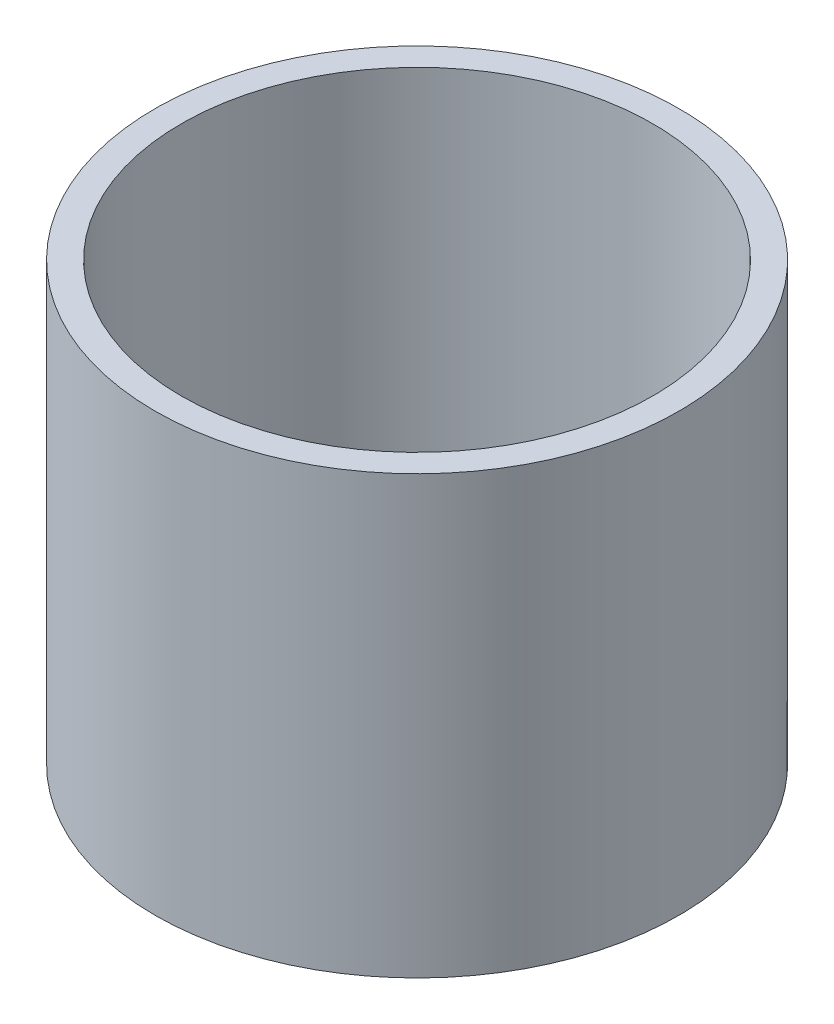
from build123d import *

# Parameters (mm, degrees)
SKETCH1_R           = 30
BOSS_EXTRUDE1_DEPTH = 50
SKETCH2_R           = 27
CUT_EXTRUDE1_DEPTH  = 47


with BuildPart() as part:
    # Sketch1 → Boss-Extrude1 (new body)
    with BuildSketch(Plane(origin=(0, 0, 0), x_dir=(1, 0, 0), z_dir=(0, 1, 0))):
        with Locations(Location((-21.650983604, 19.052865571, 0), (0, 0, 270))):
            Circle(SKETCH1_R)
    extrude(amount=BOSS_EXTRUDE1_DEPTH)

    # Sketch2 → Cut-Extrude1 (cut)
    with BuildSketch(Plane(origin=(0, 50, 0), x_dir=(1, 0, 0), z_dir=(0, 1, 0))):
        with Locations(Location((-21.650983604, 19.052865571, 0), (0, 0, 270))):
            Circle(SKETCH2_R)
    extrude(amount=-CUT_EXTRUDE1_DEPTH, mode=Mode.SUBTRACT)


solid = part.part
